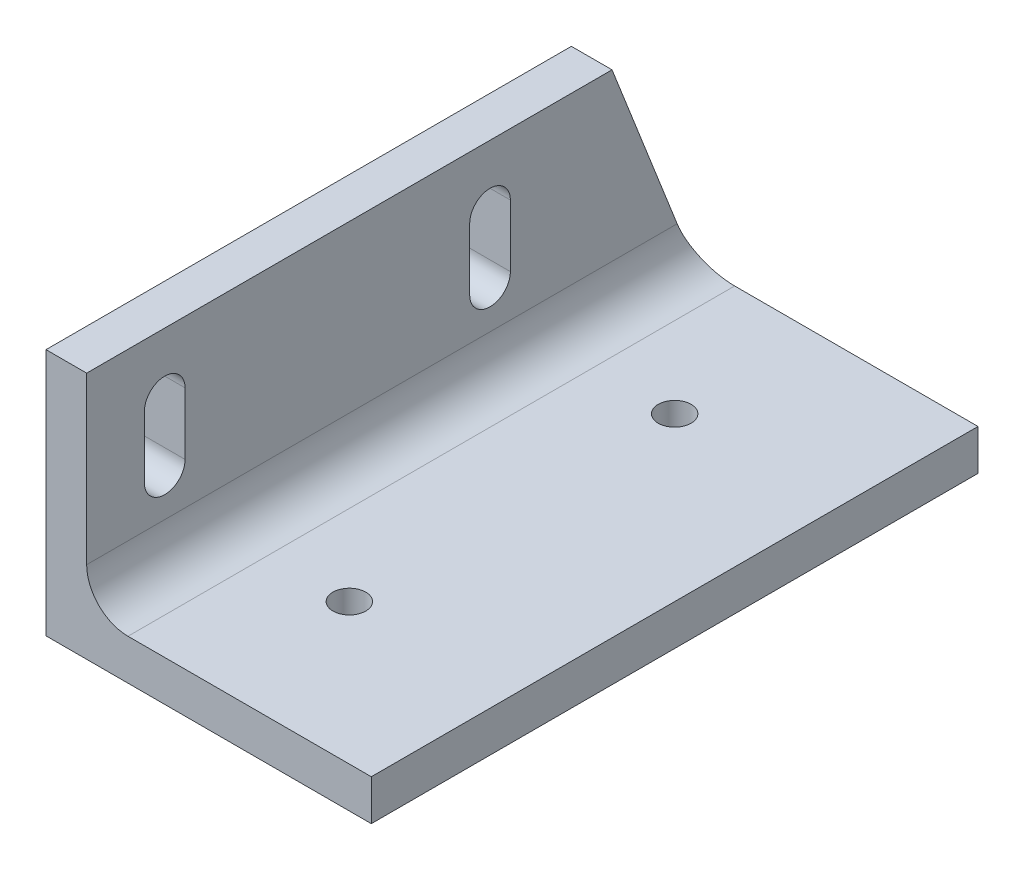
from build123d import *

# Parameters (mm, degrees)
BOSS_EXTRUDE1_DEPTH    = 74.6
CUT_EXTRUDE2_DEPTH     = 87.251900849
CUT_EXTRUDE3_DEPTH     = 10
FILLET1_R              = 5.08
F_10_32_TAPPED_HOLE1_D = 4.0386


with BuildPart() as part:
    # Sketch1 → Boss-Extrude1 (new body)
    with BuildSketch(Plane.XY):
        Polygon((0, 25.48), (0, 0), (35, 0), (35, -5), (-5, -5), (-5, 25.48), align=None)
    extrude(amount=BOSS_EXTRUDE1_DEPTH)

    # Sketch3 → Cut-Extrude2 (cut, through all)
    with BuildSketch(Plane(origin=(0, 0, 0), x_dir=(0, 0, -1), z_dir=(1, 0, 0))):
        with BuildLine():
            Line((-67.5, 10.24), (-67.5, 17.86))
            ThreePointArc((-67.5, 17.86), (-65, 20.36), (-62.5, 17.86))
            Line((-62.5, 17.86), (-62.5, 10.24))
            ThreePointArc((-62.5, 10.24), (-65, 7.74), (-67.5, 10.24))
        make_face()
        with BuildLine():
            Line((-27.5, 10.24), (-27.5, 17.86))
            ThreePointArc((-27.5, 17.86), (-25, 20.36), (-22.5, 17.86))
            Line((-22.5, 17.86), (-22.5, 10.24))
            ThreePointArc((-22.5, 10.24), (-25, 7.74), (-27.5, 10.24))
        make_face()
    extrude(amount=-CUT_EXTRUDE2_DEPTH, mode=Mode.SUBTRACT)

    # Sketch4 → Cut-Extrude3 (cut)
    with BuildSketch(Plane(origin=(0, 0, 0), x_dir=(0, 0, -1), z_dir=(1, 0, 0))):
        Polygon((-10, 25.48), (0, 0), (0, 25.48), align=None)
    extrude(amount=-CUT_EXTRUDE3_DEPTH, mode=Mode.SUBTRACT)

    # Fillet1
    fillet1_edges = [part.edges().sort_by_distance(p)[0] for p in [
        (0, 0, 37.3),
    ]]
    fillet(fillet1_edges, radius=FILLET1_R)

    # #10-32 Tapped Hole1 (through all)
    with Locations(Plane(origin=(0, 0, 0), x_dir=(1, 0, 0), z_dir=(0, 1, 0))):
        with Locations((15, -17.3), (15, -57.3)):
            Hole(F_10_32_TAPPED_HOLE1_D / 2)


solid = part.part
